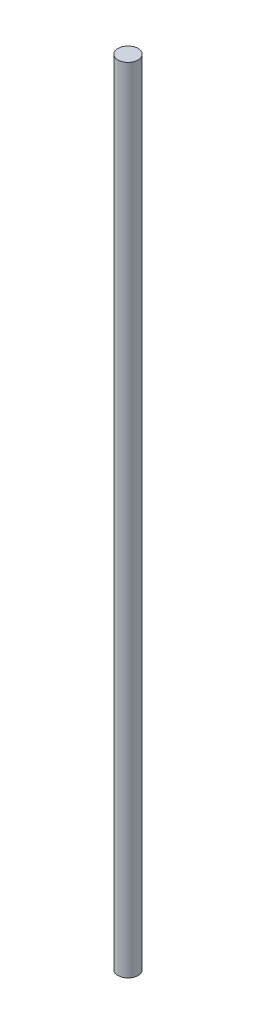
from build123d import *

# Parameters (mm, degrees)
SKETCH1_R           = 10
BOSS_EXTRUDE2_DEPTH = 790


with BuildPart() as part:
    # Sketch1 → Boss-Extrude2 (new body)
    with BuildSketch(Plane(origin=(0, 0, 0), x_dir=(1, 0, 0), z_dir=(0, 1, 0))):
        with Locations(Location((-61.643561992, 0, 0), (0, 0, 90))):
            Circle(SKETCH1_R)
    extrude(amount=BOSS_EXTRUDE2_DEPTH)


solid = part.part
